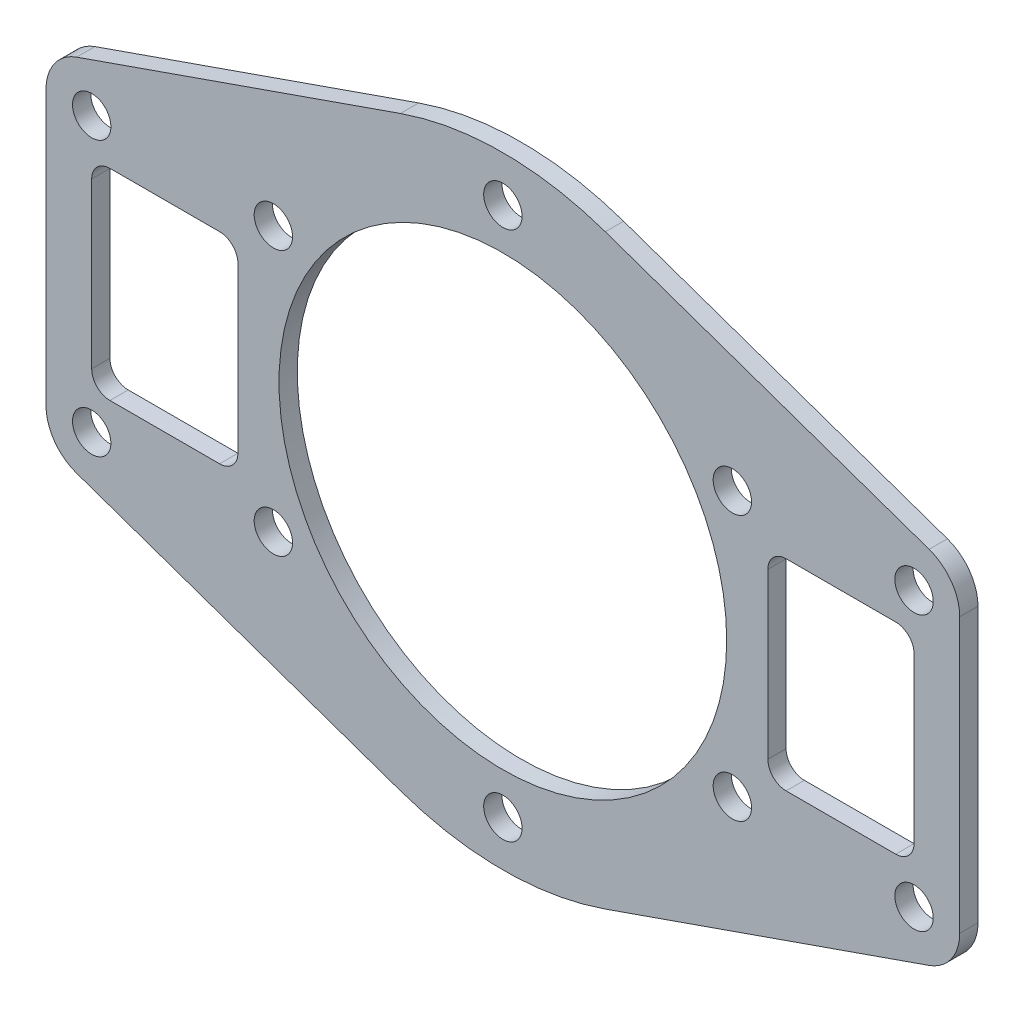
from build123d import *

# Parameters (mm, degrees)
SKETCH_1_R          = 24.5
SKETCH_1_R_2        = 2.1
EXTRUDE_1_DEPTH     = 2
CUT_EXTRUDE_1_DEPTH = 10


with BuildPart() as part:
    # 草图1 → 凸台-拉伸1 (new body)
    with BuildSketch(Plane.XY):
        with BuildLine():
            Line((-50, 15), (-50, -15))
            ThreePointArc((-50, -15), (-49.077002077, -17.894486839), (-46.648778375, -19.720331542))
            Line((-46.648778375, -19.720331542), (-11.211692948, -32.098254489))
            ThreePointArc((-11.211692948, -32.098254489), (0, -34), (11.211692948, -32.098254489))
            Line((11.211692948, -32.098254489), (46.648778375, -19.720331542))
            ThreePointArc((46.648778375, -19.720331542), (49.077002077, -17.894486839), (50, -15))
            Line((50, -15), (50, 15))
            ThreePointArc((50, 15), (49.077002077, 17.894486839), (46.648778375, 19.720331542))
            Line((46.648778375, 19.720331542), (11.211692948, 32.098254489))
            ThreePointArc((11.211692948, 32.098254489), (0, 34), (-11.211692948, 32.098254489))
            Line((-11.211692948, 32.098254489), (-46.648778375, 19.720331542))
            ThreePointArc((-46.648778375, 19.720331542), (-49.077002077, 17.894486839), (-50, 15))
        make_face()
        Circle(SKETCH_1_R, mode=Mode.SUBTRACT)
        with Locations((0, 29)):
            Circle(SKETCH_1_R_2, mode=Mode.SUBTRACT)
        with Locations((25.11473671, 14.5)):
            Circle(SKETCH_1_R_2, mode=Mode.SUBTRACT)
        with Locations((25.11473671, -14.5)):
            Circle(SKETCH_1_R_2, mode=Mode.SUBTRACT)
        with Locations((0, -29)):
            Circle(SKETCH_1_R_2, mode=Mode.SUBTRACT)
        with Locations((-25.11473671, -14.5)):
            Circle(SKETCH_1_R_2, mode=Mode.SUBTRACT)
        with Locations((-25.11473671, 14.5)):
            Circle(SKETCH_1_R_2, mode=Mode.SUBTRACT)
        with Locations((-45, 15)):
            Circle(SKETCH_1_R_2, mode=Mode.SUBTRACT)
        with Locations((-45, -15)):
            Circle(SKETCH_1_R_2, mode=Mode.SUBTRACT)
        with Locations((45, -15)):
            Circle(SKETCH_1_R_2, mode=Mode.SUBTRACT)
        with Locations((45, 15)):
            Circle(SKETCH_1_R_2, mode=Mode.SUBTRACT)
    extrude(amount=EXTRUDE_1_DEPTH)

    # 草图2 → 切除-拉伸1 (cut)
    with BuildSketch(Plane.XY.offset(2)):
        with BuildLine():
            Line((-43, 11), (-31, 11))
            ThreePointArc((-31, 11), (-29.585786438, 10.414213562), (-29, 9))
            Line((-29, 9), (-29, -9))
            ThreePointArc((-29, -9), (-29.585786438, -10.414213562), (-31, -11))
            Line((-31, -11), (-43, -11))
            ThreePointArc((-43, -11), (-44.414213562, -10.414213562), (-45, -9))
            Line((-45, -9), (-45, 9))
            ThreePointArc((-45, 9), (-44.414213562, 10.414213562), (-43, 11))
        make_face()
        with BuildLine():
            Line((31, 11), (43, 11))
            ThreePointArc((43, 11), (44.414213562, 10.414213562), (45, 9))
            Line((45, 9), (45, -9))
            ThreePointArc((45, -9), (44.414213562, -10.414213562), (43, -11))
            Line((43, -11), (31, -11))
            ThreePointArc((31, -11), (29.585786438, -10.414213562), (29, -9))
            Line((29, -9), (29, 9))
            ThreePointArc((29, 9), (29.585786438, 10.414213562), (31, 11))
        make_face()
    extrude(amount=-CUT_EXTRUDE_1_DEPTH, mode=Mode.SUBTRACT)


solid = part.part
